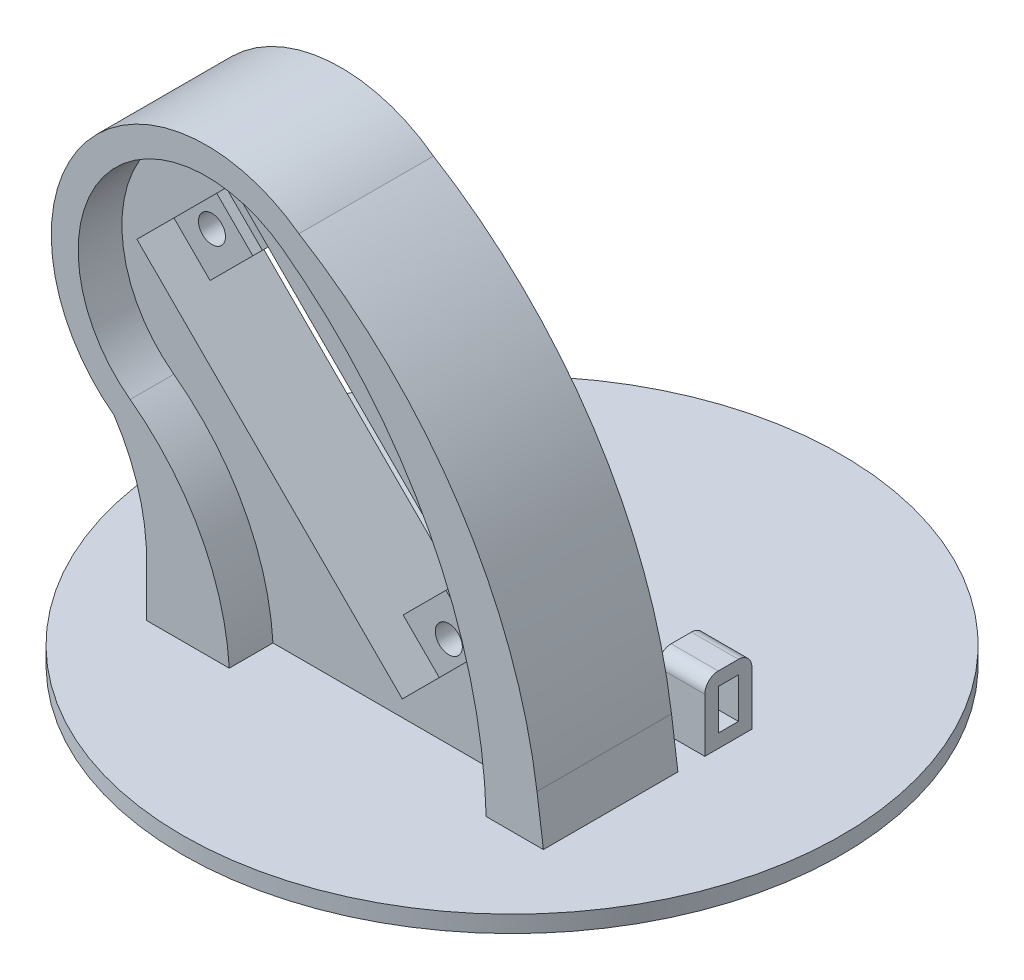
from build123d import *

# Parameters (mm, degrees)
SKETCH1_R           = 49
BOSS_EXTRUDE1_DEPTH = 4
BOSS_EXTRUDE2_DEPTH = 20
BOSS_EXTRUDE3_DEPTH = 13.5
SKETCH3_4_R         = 6
BOSS_EXTRUDE4_DEPTH = 13.5
CUT_EXTRUDE5_DEPTH  = 5.5
CUT_EXTRUDE6_DEPTH  = 9
SKETCH11_W          = 7
SKETCH11_H          = 7
BOSS_EXTRUDE5_DEPTH = 10
CUT_EXTRUDE9_REACH  = 112.656
SKETCH12_W          = 3
SKETCH12_H          = 6
FILLET1_R           = 2
CUT_EXTRUDE10_REACH = 97.458
SKETCH13_R          = 1.27
CUT_EXTRUDE11_DEPTH = 95
CUT_EXTRUDE12_DEPTH = 2
CUT_EXTRUDE13_DEPTH = 2
CUT_EXTRUDE14_REACH = 97.458
SKETCH17_R          = 1.09
CUT_EXTRUDE15_REACH = 106.754
SKETCH18_R          = 2.01


with BuildPart() as part:
    # Sketch1 → Boss-Extrude1 (new body)
    with BuildSketch(Plane(origin=(0, 0, 0), x_dir=(1, 0, 0), z_dir=(0, 1, 0))):
        with Locations(Location((0, 0, 0), (0, 0, 270))):
            Circle(SKETCH1_R)
    extrude(amount=BOSS_EXTRUDE1_DEPTH)

    # Sketch3 → Boss-Extrude2 (add)
    with BuildSketch(Plane.XY.offset(4)):
        with BuildLine():
            Line((-30.347886599, 11), (-30.347886599, 4))
            Line((-30.347886599, 4), (-18.049754955, 4))
            ThreePointArc((-18.049754955, 4), (-22.391739007, 19.253033546), (-32.784586802, 31.232039038))
            ThreePointArc((-32.784586802, 31.232039038), (-36.760767526, 57.926722426), (-10.066084138, 61.902903149))
            ThreePointArc((-10.066084138, 61.902903149), (11.703451168, 36.427560581), (20.150880429, 4))
            Line((20.150880429, 4), (28.656645727, 4))
            Line((28.656645727, 4), (27.702300884, 11))
            ThreePointArc((27.702300884, 11), (16.110760067, 42.048857672), (-7.685218322, 65.117164801))
            ThreePointArc((-7.685218322, 65.117164801), (-39.975029178, 60.307588242), (-35.165452618, 28.017777386))
            ThreePointArc((-35.165452618, 28.017777386), (-31.452519142, 19.87808091), (-30.347886599, 11))
        make_face()
    extrude(amount=BOSS_EXTRUDE2_DEPTH)

    # Sketch3<3> → Boss-Extrude3 (add)
    with BuildSketch(Plane.XY.offset(4)):
        with BuildLine():
            ThreePointArc((-32.784586802, 31.232039038), (-22.391739007, 19.253033546), (-18.049754955, 4))
            Line((-18.049754955, 4), (20.150880429, 4))
            ThreePointArc((20.150880429, 4), (11.703451168, 36.427560581), (-10.066084138, 61.902903149))
            ThreePointArc((-10.066084138, 61.902903149), (-36.760767526, 57.926722426), (-32.784586802, 31.232039038))
        make_face()
        Polygon((14.142135624, 25.142135624), (0, 11), (-28.496403282, 39.496403282), (-14.354267658, 53.638538906), align=None, mode=Mode.SUBTRACT)
    extrude(amount=BOSS_EXTRUDE3_DEPTH)

    # Sketch3<4> → Boss-Extrude4 (add)
    # profile 1 of 2: a face of its own
    with BuildSketch(Plane.XY.offset(4)):
        Polygon((-28.496403282, 39.496403282), (-14.354267658, 53.638538906), (14.142135624, 25.142135624), (0, 11), align=None)
        with Locations((-14.297699116, 39.439834739)):
            Circle(SKETCH3_4_R, mode=Mode.SUBTRACT)
    # profile 2 of 2: a face of its own
    with BuildSketch(Plane.XY.offset(4)):
        with Locations((-14.297699116, 39.439834739)):
            Circle(SKETCH3_4_R)
    extrude(amount=BOSS_EXTRUDE4_DEPTH)

    # Sketch5 → Cut-Extrude5 (cut)
    with BuildSketch(Plane.XY.offset(17.5)):
        Polygon((15.321499667, 20.547344219), (-24.135058723, 60.003902609), (-38.277194347, 45.861766985), (1.179364043, 6.405208595), align=None)
    extrude(amount=-CUT_EXTRUDE5_DEPTH, mode=Mode.SUBTRACT)

    # Sketch8 → Cut-Extrude6 (cut)
    with BuildSketch(Plane.XY.offset(12)):
        Polygon((-18.761047186, 54.629891072), (-32.90318281, 40.487755448), (-4.194647494, 11.779220132), (9.94748813, 25.921355756), align=None)
    extrude(amount=-CUT_EXTRUDE6_DEPTH, mode=Mode.SUBTRACT)

    # Sketch11 → Boss-Extrude5 (add)
    with BuildSketch(Plane(origin=(0, 4, 0), x_dir=(1, 0, 0), z_dir=(0, 1, 0))):
        with Locations((25.156645727, 3.5)):
            Rectangle(SKETCH11_W, SKETCH11_H)
    extrude(amount=BOSS_EXTRUDE5_DEPTH)

    # Sketch12 → Cut-Extrude9 (cut, up to next)
    with BuildSketch(Plane.ZY.offset(-21.656645727), mode=Mode.PRIVATE) as cut_extrude9_sk1:
        with Locations((-3.5, 9)):
            Rectangle(SKETCH12_W, SKETCH12_H)
    cut_extrude9_tool1 = extrude(cut_extrude9_sk1.sketch, amount=-CUT_EXTRUDE9_REACH, mode=Mode.PRIVATE) & part.part
    add(cut_extrude9_tool1.solids().sort_by_distance((21.656646, 9, -3.5))[0], mode=Mode.SUBTRACT)

    # Fillet1
    fillet1_edges = [part.edges().sort_by_distance(p)[0] for p in [
        (25.156645727, 14, 0),
        (25.156645727, 14, -7),
    ]]
    fillet(fillet1_edges, radius=FILLET1_R)

    # Sketch13 → Cut-Extrude10 (cut, up to next)
    with BuildSketch(Plane(origin=(0, 4, 0), x_dir=(1, 0, 0), z_dir=(0, 1, 0)), mode=Mode.PRIVATE) as cut_extrude10_sk1:
        with Locations(Location((0, 0, 0), (0, 0, 270))):
            Circle(SKETCH13_R)
    cut_extrude10_tool1 = extrude(cut_extrude10_sk1.sketch, amount=-CUT_EXTRUDE10_REACH, mode=Mode.PRIVATE) & part.part
    add(cut_extrude10_tool1.solids().sort_by_distance((0, 4, 0))[0], mode=Mode.SUBTRACT)

    # Sketch14 → Cut-Extrude11 (cut, symmetric)
    with BuildSketch(Plane.XY.offset(17.5)):
        Polygon((-49, 1.5), (50.231696903, 1.5), (50.231696903, 0), (-50.303866734, 0), (-50.303866734, 1.5), align=None)
    extrude(amount=CUT_EXTRUDE11_DEPTH, both=True, mode=Mode.SUBTRACT)

    # Sketch16 → Cut-Extrude12 (cut)
    with BuildSketch(Plane.XY.offset(12)):
        Polygon((3.583527099, 19.557394725), (2.876420318, 18.850287944), (8.250431855, 13.476276407), (8.957538636, 14.183383188), align=None)
        Polygon((8.250431855, 13.476276407), (2.876420318, 18.850287944), (2.169313537, 18.143181163), (7.543325074, 12.769169626), align=None)
    extrude(amount=-CUT_EXTRUDE12_DEPTH, mode=Mode.SUBTRACT)

    # Sketch16<3> → Cut-Extrude13 (cut)
    with BuildSketch(Plane.XY.offset(12)):
        Polygon((-25.832114998, 47.55882326), (-31.206126535, 52.932834797), (-31.913233317, 52.225728016), (-26.53922178, 46.851716479), align=None)
        Polygon((-30.499019754, 53.639941578), (-31.206126535, 52.932834797), (-25.832114998, 47.55882326), (-25.125008217, 48.265930041), align=None)
    extrude(amount=-CUT_EXTRUDE13_DEPTH, mode=Mode.SUBTRACT)

    # Sketch17 → Cut-Extrude14 (cut, up to next)
    with BuildSketch(Plane(origin=(0, 4, 0), x_dir=(1, 0, 0), z_dir=(0, 1, 0)), mode=Mode.PRIVATE) as cut_extrude14_sk1:
        with Locations(Location((8.18, 0, 0), (0, 0, 270))):
            Circle(SKETCH17_R)
    cut_extrude14_tool1 = extrude(cut_extrude14_sk1.sketch, amount=-CUT_EXTRUDE14_REACH, mode=Mode.PRIVATE) & part.part
    # Sketch17 → Cut-Extrude14 (cut, up to next)
    with BuildSketch(Plane(origin=(0, 4, 0), x_dir=(1, 0, 0), z_dir=(0, 1, 0)), mode=Mode.PRIVATE) as cut_extrude14_sk2:
        with Locations(Location((-8.18, 0, 0), (0, 0, 270))):
            Circle(SKETCH17_R)
    cut_extrude14_tool2 = extrude(cut_extrude14_sk2.sketch, amount=-CUT_EXTRUDE14_REACH, mode=Mode.PRIVATE) & part.part
    # Sketch17 → Cut-Extrude14 (cut, up to next)
    with BuildSketch(Plane(origin=(0, 4, 0), x_dir=(1, 0, 0), z_dir=(0, 1, 0)), mode=Mode.PRIVATE) as cut_extrude14_sk3:
        with Locations(Location((0, 8.18, 0), (0, 0, 270))):
            Circle(SKETCH17_R)
    cut_extrude14_tool3 = extrude(cut_extrude14_sk3.sketch, amount=-CUT_EXTRUDE14_REACH, mode=Mode.PRIVATE) & part.part
    add(cut_extrude14_tool1.solids().sort_by_distance((8.18, 4, 0))[0], mode=Mode.SUBTRACT)
    add(cut_extrude14_tool2.solids().sort_by_distance((-8.18, 4, 0))[0], mode=Mode.SUBTRACT)
    add(cut_extrude14_tool3.solids().sort_by_distance((0, 4, -8.18))[0], mode=Mode.SUBTRACT)

    # Sketch18 → Cut-Extrude15 (cut, up to next)
    with BuildSketch(Plane.XY.offset(12), mode=Mode.PRIVATE) as cut_extrude15_sk1:
        with Locations((2.593577605, 12.062062844)):
            Circle(SKETCH18_R)
    cut_extrude15_tool1 = extrude(cut_extrude15_sk1.sketch, amount=-CUT_EXTRUDE15_REACH, mode=Mode.PRIVATE) & part.part
    # Sketch18 → Cut-Extrude15 (cut, up to next)
    with BuildSketch(Plane.XY.offset(12), mode=Mode.PRIVATE) as cut_extrude15_sk2:
        with Locations((9.664645417, 19.133130656)):
            Circle(SKETCH18_R)
    cut_extrude15_tool2 = extrude(cut_extrude15_sk2.sketch, amount=-CUT_EXTRUDE15_REACH, mode=Mode.PRIVATE) & part.part
    # Sketch18 → Cut-Extrude15 (cut, up to next)
    with BuildSketch(Plane.XY.offset(12), mode=Mode.PRIVATE) as cut_extrude15_sk3:
        with Locations((-32.620340098, 47.275980548)):
            Circle(SKETCH18_R)
    cut_extrude15_tool3 = extrude(cut_extrude15_sk3.sketch, amount=-CUT_EXTRUDE15_REACH, mode=Mode.PRIVATE) & part.part
    # Sketch18 → Cut-Extrude15 (cut, up to next)
    with BuildSketch(Plane.XY.offset(12), mode=Mode.PRIVATE) as cut_extrude15_sk4:
        with Locations((-25.549272286, 54.347048359)):
            Circle(SKETCH18_R)
    cut_extrude15_tool4 = extrude(cut_extrude15_sk4.sketch, amount=-CUT_EXTRUDE15_REACH, mode=Mode.PRIVATE) & part.part
    add(cut_extrude15_tool1.solids().sort_by_distance((2.593578, 12.062063, 12))[0], mode=Mode.SUBTRACT)
    add(cut_extrude15_tool2.solids().sort_by_distance((9.664645, 19.133131, 12))[0], mode=Mode.SUBTRACT)
    add(cut_extrude15_tool3.solids().sort_by_distance((-32.62034, 47.275981, 12))[0], mode=Mode.SUBTRACT)
    add(cut_extrude15_tool4.solids().sort_by_distance((-25.549272, 54.347048, 12))[0], mode=Mode.SUBTRACT)


solid = part.part
